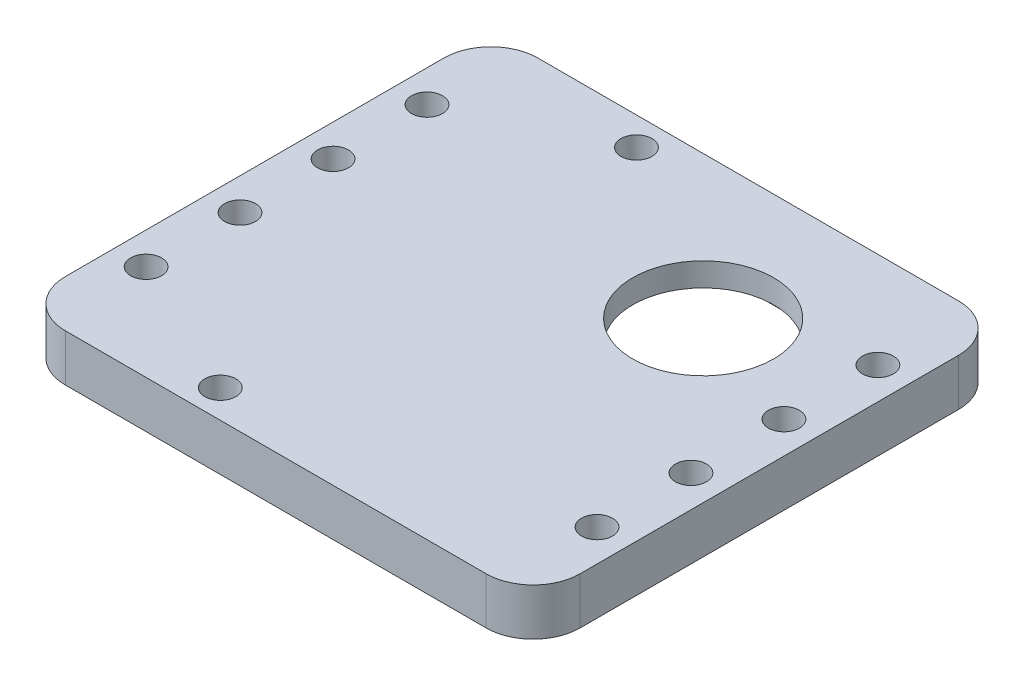
from build123d import *

# Parameters (mm, degrees)
EXTRUSION1_DEPTH        = 5
ENL_V_MAT_EXTRU_2_DEPTH = 2.5
ENL_V_MAT_EXTRU_4_DEPTH = 1.8
ESQUISSE7_R             = 7.5
ENL_V_MAT_EXTRU_3_DEPTH = 52.643973511
TROU_TARAUD_M4X0_71_D   = 3.3


with BuildPart() as part:
    # Esquisse1 → Extrusion1 (new body)
    with BuildSketch(Plane(origin=(0, 0, 0), x_dir=(1, 0, 0), z_dir=(0, 1, 0))):
        with BuildLine():
            Line((-32.8, -35.1), (12, -35.1))
            ThreePointArc((12, -35.1), (15.535533906, -33.635533906), (17, -30.1))
            Line((17, -30.1), (17, 10.2))
            ThreePointArc((17, 10.2), (15.535533906, 13.735533906), (12, 15.2))
            Line((12, 15.2), (-32.8, 15.2))
            ThreePointArc((-32.8, 15.2), (-36.335533906, 13.735533906), (-37.8, 10.2))
            Line((-37.8, 10.2), (-37.8, -30.1))
            ThreePointArc((-37.8, -30.1), (-36.335533906, -33.635533906), (-32.8, -35.1))
        make_face()
    extrude(amount=-EXTRUSION1_DEPTH)

    # Esquisse6 → Enlèv. mat.-Extru.2 (cut)
    with BuildSketch(Plane.XZ.offset(5)):
        with BuildLine():
            Line((1, 9.95), (-21.8, 9.95))
            ThreePointArc((-21.8, 9.95), (-28.163961031, 7.313961031), (-30.8, 0.95))
            Line((-30.8, 0.95), (-30.8, -0.95))
            ThreePointArc((-30.8, -0.95), (-28.163961031, -7.313961031), (-21.8, -9.95))
            Line((-21.8, -9.95), (1, -9.95))
            ThreePointArc((1, -9.95), (7.363961031, -7.313961031), (10, -0.95))
            Line((10, -0.95), (10, 0.95))
            ThreePointArc((10, 0.95), (7.363961031, 7.313961031), (1, 9.95))
        make_face()
    extrude(amount=-ENL_V_MAT_EXTRU_2_DEPTH, mode=Mode.SUBTRACT)

    # Esquisse10 → Enlèv. mat.-Extru.4 (cut)
    with BuildSketch(Plane.XZ.offset(5)):
        with BuildLine():
            Line((8, 9.95), (-28.8, 9.95))
            ThreePointArc((-28.8, 9.95), (-30.214213562, 10.535786438), (-30.8, 11.95))
            Line((-30.8, 11.95), (-30.8, 27.85))
            ThreePointArc((-30.8, 27.85), (-30.214213562, 29.264213562), (-28.8, 29.85))
            Line((-28.8, 29.85), (8, 29.85))
            ThreePointArc((8, 29.85), (9.414213562, 29.264213562), (10, 27.85))
            Line((10, 27.85), (10, 11.95))
            ThreePointArc((10, 11.95), (9.414213562, 10.535786438), (8, 9.95))
        make_face()
    extrude(amount=-ENL_V_MAT_EXTRU_4_DEPTH, mode=Mode.SUBTRACT)

    # Esquisse7 → Enlèv. mat.-Extru.3 (cut, through all)
    with BuildSketch(Plane.XZ.offset(2.5)):
        Circle(ESQUISSE7_R)
    extrude(amount=-ENL_V_MAT_EXTRU_3_DEPTH, mode=Mode.SUBTRACT)

    # Trou taraudé M4x0.71 (through all)
    with Locations(Plane.XZ.offset(5)):
        with Locations((-34.4, 5), (-34.4, -5), (13.6, 5), (13.6, -5), (-19.3, -12.2), (-19.3, 32.1), (13.6, 24.9), (13.6, 14.9), (-34.4, 14.9), (-34.4, 24.9)):
            Hole(TROU_TARAUD_M4X0_71_D / 2)


solid = part.part
